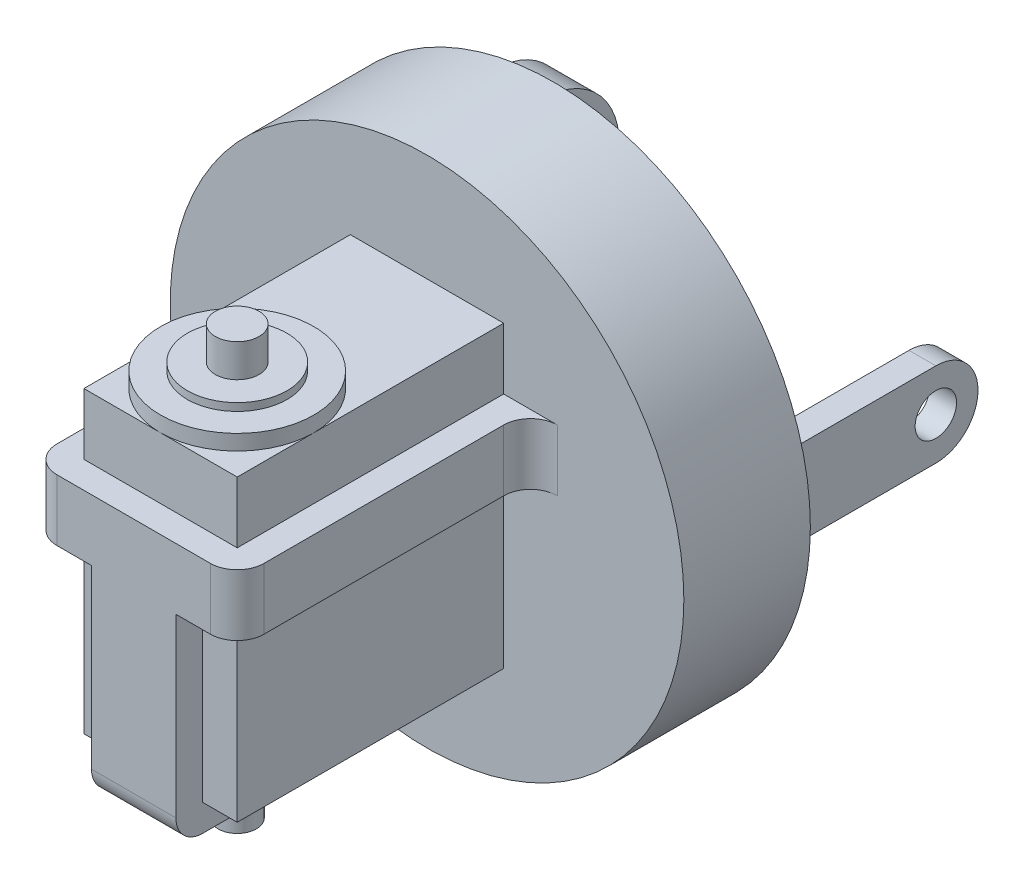
from build123d import *

# Parameters (mm, degrees)
SKETCH1_R            = 33.5
BOSS_EXTRUDE3_DEPTH  = 16.5
SKETCH2_W            = 20
SKETCH2_H            = 39
BOSS_EXTRUDE4_DEPTH  = 34.758
SKETCH3_R            = 10
SKETCH3_R_2          = 6.5
BOSS_EXTRUDE5_DEPTH  = 2
SKETCH3_3_R          = 6.5
BOSS_EXTRUDE6_DEPTH  = 3
SKETCH3_4_R          = 2.85
BOSS_EXTRUDE7_DEPTH  = 7.3
SKETCH5_W            = 11
SKETCH5_H            = 3.5
SKETCH5_W_2          = 3.5
SKETCH5_H_2          = 8
BOSS_EXTRUDE8_DEPTH  = 34.758
SKETCH6_W            = 11
SKETCH6_H            = 8
BOSS_EXTRUDE9_DEPTH  = 3.5
SKETCH7_R            = 2.5
BOSS_EXTRUDE10_DEPTH = 6
FILLET1_R            = 3.5
FILLET2_R            = 3.5
FILLET3_R            = 3.5
FILLET4_R            = 3.5
SKETCH9_W            = 3.5
SKETCH9_H            = 20
BOSS_EXTRUDE11_DEPTH = 30.867
SKETCH9_3_W          = 3.5
SKETCH9_3_H          = 11
BOSS_EXTRUDE12_DEPTH = 27
CUT_EXTRUDE1_DEPTH   = 88.052447203
BOSS_EXTRUDE13_START = 3
SKETCH10_3_R         = 10
BOSS_EXTRUDE13_DEPTH = 3
SKETCH10_4_R         = 5
SKETCH10_4_R_2       = 3
BOSS_EXTRUDE14_DEPTH = 4.5
CUT_EXTRUDE4_START   = -18.5
SKETCH10_7_R         = 1.5
CUT_EXTRUDE4_DEPTH   = 34.5
CIRPATTERN3_COUNT    = 4
SKETCH11_R           = 1.5
CUT_EXTRUDE6_DEPTH   = 86.054856205
SKETCH13_R           = 2.7
CUT_EXTRUDE10_DEPTH  = 15.5
CUT_EXTRUDE11_DEPTH  = 3.5
CIRPATTERN4_COUNT    = 4
SKETCH14_3_R         = 1.25
CUT_EXTRUDE12_DEPTH  = 3.5


with BuildPart() as part:
    # Sketch1 → Boss-Extrude3 (new body)
    with BuildSketch(Plane.XY):
        Circle(SKETCH1_R)
    extrude(amount=BOSS_EXTRUDE3_DEPTH)

    # Sketch2 → Boss-Extrude4 (add)
    with BuildSketch(Plane.XY.offset(16.5)):
        Rectangle(SKETCH2_W, SKETCH2_H)
    extrude(amount=BOSS_EXTRUDE4_DEPTH)

    # Sketch3 → Boss-Extrude5 (add)
    with BuildSketch(Plane(origin=(0, 19.5, 0), x_dir=(1, 0, 0), z_dir=(0, 1, 0))):
        with Locations(Location((0, -41.258, 0), (0, 0, 270))):
            Circle(SKETCH3_R)
        with Locations(Location((0, -41.258, 0), (0, 0, 270))):
            Circle(SKETCH3_R_2, mode=Mode.SUBTRACT)
    extrude(amount=BOSS_EXTRUDE5_DEPTH)

    # Sketch3<3> → Boss-Extrude6 (add)
    with BuildSketch(Plane(origin=(0, 19.5, 0), x_dir=(1, 0, 0), z_dir=(0, 1, 0))):
        with Locations(Location((0, -41.258, 0), (0, 0, 270))):
            Circle(SKETCH3_3_R)
    extrude(amount=BOSS_EXTRUDE6_DEPTH)

    # Sketch3<4> → Boss-Extrude7 (add)
    with BuildSketch(Plane(origin=(0, 19.5, 0), x_dir=(1, 0, 0), z_dir=(0, 1, 0))):
        with Locations(Location((0, -41.258, 0), (0, 0, 270))):
            Circle(SKETCH3_4_R)
    extrude(amount=BOSS_EXTRUDE7_DEPTH)

    # Sketch5 → Boss-Extrude8 (add)
    with BuildSketch(Plane.XY.offset(51.258)):
        with Locations((0, -21.25)):
            Rectangle(SKETCH5_W, SKETCH5_H)
        with Locations((11.75, 7.5)):
            Rectangle(SKETCH5_W_2, SKETCH5_H_2)
        with Locations((-11.75, 7.5)):
            Rectangle(SKETCH5_W_2, SKETCH5_H_2)
    extrude(amount=-BOSS_EXTRUDE8_DEPTH)

    # Sketch6 → Boss-Extrude9 (add)
    with BuildSketch(Plane.XY.offset(51.258)):
        with Locations((0, 7.5)):
            Rectangle(SKETCH6_W, SKETCH6_H)
        Polygon((10, 11.5), (5.5, 11.5), (5.5, 3.5), (10, 3.5), (13.5, 3.5), (13.5, 11.5), align=None)
        Polygon((5.5, 3.5), (-5.5, 3.5), (-5.5, -19.5), (-5.5, -23), (5.5, -23), (5.5, -19.5), align=None)
        Polygon((-10, 11.5), (-13.5, 11.5), (-13.5, 3.5), (-10, 3.5), (-5.5, 3.5), (-5.5, 11.5), align=None)
    extrude(amount=BOSS_EXTRUDE9_DEPTH)

    # Sketch7 → Boss-Extrude10 (add)
    with BuildSketch(Plane.XZ.offset(23)):
        with Locations(Location((0, 41.258, 0), (0, 0, 270))):
            Circle(SKETCH7_R)
    extrude(amount=BOSS_EXTRUDE10_DEPTH)

    # Fillet1
    fillet1_edges = [part.edges().sort_by_distance(p)[0] for p in [
        (-13.5, 7.5, 54.758),
        (13.5, 7.5, 54.758),
    ]]
    fillet(fillet1_edges, radius=FILLET1_R)

    # Fillet2
    fillet2_edges = [part.edges().sort_by_distance(p)[0] for p in [
        (0, -23, 54.758),
    ]]
    fillet(fillet2_edges, radius=FILLET2_R)

    # Fillet3
    fillet3_edges = [part.edges().sort_by_distance(p)[0] for p in [
        (13.5, 7.5, 16.5),
    ]]
    fillet(fillet3_edges, radius=FILLET3_R)

    # Fillet4
    fillet4_edges = [part.edges().sort_by_distance(p)[0] for p in [
        (-13.5, 7.5, 16.5),
    ]]
    fillet(fillet4_edges, radius=FILLET4_R)

    # Sketch9 → Boss-Extrude11 (add)
    with BuildSketch(Plane(origin=(0, 0, 0), x_dir=(-1, 0, 0), z_dir=(0, 0, -1))):
        with Locations((27.05, 0)):
            Rectangle(SKETCH9_W, SKETCH9_H)
    extrude(amount=BOSS_EXTRUDE11_DEPTH)

    # Sketch9<3> → Boss-Extrude12 (add)
    with BuildSketch(Plane(origin=(0, 0, 0), x_dir=(-1, 0, 0), z_dir=(0, 0, -1))):
        with Locations((-27.25, 0)):
            Rectangle(SKETCH9_3_W, SKETCH9_3_H)
    extrude(amount=BOSS_EXTRUDE12_DEPTH)

    # Sketch10 → Cut-Extrude1 (cut, through all)
    with BuildSketch(Plane(origin=(-25.3, 0, 0), x_dir=(0, 0, -1), z_dir=(1, 0, 0))):
        with BuildLine():
            ThreePointArc((20.867, 10), (27.938067812, 7.071067812), (30.867, 0))
            Line((30.867, 0), (30.867, 10))
            Line((30.867, 10), (20.867, 10))
        make_face()
        with BuildLine():
            Line((30.867, -10), (30.867, 0))
            ThreePointArc((30.867, 0), (27.938067812, -7.071067812), (20.867, -10))
            Line((20.867, -10), (30.867, -10))
        make_face()
    extrude(amount=-CUT_EXTRUDE1_DEPTH, mode=Mode.SUBTRACT)

    # Sketch10<3> → Boss-Extrude13 (add)
    with BuildSketch(Plane(origin=(-25.3, 0, 0), x_dir=(0, 0, -1), z_dir=(1, 0, 0)).offset(BOSS_EXTRUDE13_START)):
        with Locations(Location((20.867, 0, 0), (0, 0, 90))):
            Circle(SKETCH10_3_R)
    extrude(amount=-BOSS_EXTRUDE13_DEPTH)

    # Sketch10<4> → Boss-Extrude14 (add)
    with BuildSketch(Plane(origin=(-25.3, 0, 0), x_dir=(0, 0, -1), z_dir=(1, 0, 0))):
        with Locations(Location((20.867, 0, 0), (0, 0, 90))):
            Circle(SKETCH10_4_R)
        with Locations(Location((20.867, 0, 0), (0, 0, 90))):
            Circle(SKETCH10_4_R_2, mode=Mode.SUBTRACT)
    extrude(amount=BOSS_EXTRUDE14_DEPTH)

    # Sketch10<7> → Cut-Extrude4 (cut)
    with BuildSketch(Plane(origin=(-25.3, 0, 0), x_dir=(0, 0, -1), z_dir=(1, 0, 0)).offset(CUT_EXTRUDE4_START)):
        with Locations(Location((20.867, -7, 0), (0, 0, 180))):
            Circle(SKETCH10_7_R)
    cut_extrude4 = extrude(amount=CUT_EXTRUDE4_DEPTH, mode=Mode.SUBTRACT)

    # CirPattern3: Cut-Extrude4 ×4 about axis
    cirpattern3_axis = Axis((0, 0, -20.867), (1, 0, 0))
    for i in range(1, CIRPATTERN3_COUNT):
        add(cut_extrude4.rotate(cirpattern3_axis, i * 360 / CIRPATTERN3_COUNT), mode=Mode.SUBTRACT)

    # Sketch11 → Cut-Extrude6 (cut, through all)
    with BuildSketch(Plane(origin=(-22.3, 0, 0), x_dir=(0, 0, -1), z_dir=(1, 0, 0))):
        with Locations(Location((20.867, 0, 0), (0, 0, 90))):
            Circle(SKETCH11_R)
    extrude(amount=-CUT_EXTRUDE6_DEPTH, mode=Mode.SUBTRACT)

    # Sketch13 → Cut-Extrude10 (cut)
    with BuildSketch(Plane(origin=(29, 0, 0), x_dir=(0, 0, -1), z_dir=(1, 0, 0))):
        with BuildLine():
            ThreePointArc((20.867, 5.5), (24.756087297, 3.889087297), (26.367, 0))
            ThreePointArc((26.367, 0), (24.756087297, -3.889087297), (20.867, -5.5))
            Line((20.867, -5.5), (27, -5.5))
            Line((27, -5.5), (27, 5.5))
            Line((27, 5.5), (20.867, 5.5))
        make_face()
        with Locations((20.867, 0)):
            Circle(SKETCH13_R)
    extrude(amount=-CUT_EXTRUDE10_DEPTH, mode=Mode.SUBTRACT)

    # Sketch14 → Cut-Extrude11 (cut)
    with BuildSketch(Plane(origin=(0, 0, 0), x_dir=(-1, 0, 0), z_dir=(0, 0, -1))):
        with BuildLine():
            Line((0, 18), (0, 9))
            ThreePointArc((0, 9), (2.329371406, 8.693332437), (4.5, 7.794228634))
            Line((4.5, 7.794228634), (9, 15.588457268))
            ThreePointArc((9, 15.588457268), (4.658742812, 17.386664873), (0, 18))
        make_face()
        with BuildLine():
            ThreePointArc((-4.5, 7.794228634), (-2.329371406, 8.693332437), (0, 9))
            Line((0, 9), (0, 18))
            ThreePointArc((0, 18), (-4.658742812, 17.386664873), (-9, 15.588457268))
            Line((-9, 15.588457268), (-4.5, 7.794228634))
        make_face()
    cut_extrude11 = extrude(amount=-CUT_EXTRUDE11_DEPTH, mode=Mode.SUBTRACT)

    # CirPattern4: Cut-Extrude11 ×4 about axis
    cirpattern4_axis = Axis((0, 0, 0), (0, 0, 1))
    for i in range(1, CIRPATTERN4_COUNT):
        add(cut_extrude11.rotate(cirpattern4_axis, i * 360 / CIRPATTERN4_COUNT), mode=Mode.SUBTRACT)

    # Sketch14<3> → Cut-Extrude12 (cut)
    with BuildSketch(Plane(origin=(0, 0, 0), x_dir=(-1, 0, 0), z_dir=(0, 0, -1))):
        Circle(SKETCH14_3_R)
    extrude(amount=-CUT_EXTRUDE12_DEPTH, mode=Mode.SUBTRACT)


solid = part.part
